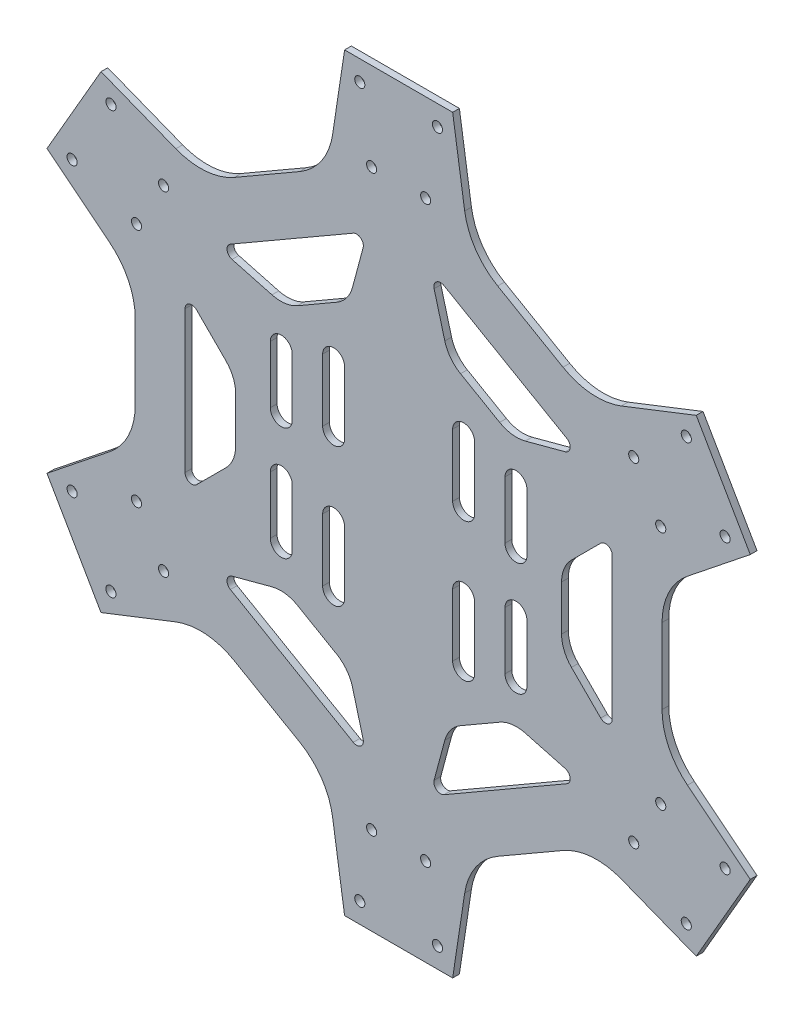
from build123d import *

# Parameters (mm, degrees)
BOSS_EXTRUDE1_DEPTH = 2
CUT_EXTRUDE1_REACH  = 306.4
CUT_EXTRUDE2_REACH  = 306.4
CUT_EXTRUDE3_REACH  = 306.4
SKETCH4_R           = 1.5


with BuildPart() as part:
    # Sketch1 → Boss-Extrude1 (new body)
    with BuildSketch(Plane.XY):
        with BuildLine():
            Line((88.12881982, 222), (84.568261253, 198.459214885))
            ThreePointArc((84.568261253, 198.459214885), (81.315061134, 190.17956792), (74.793177049, 184.129700743))
            Line((74.793177049, 184.129700743), (55.464462591, 172.970262248))
            ThreePointArc((55.464462591, 172.970262248), (46.964181884, 170.347078538), (38.167197219, 171.669548074))
            Line((38.167197219, 171.669548074), (16, 180.356406461))
            Line((16, 180.356406461), (0, 152.643593539))
            Line((0, 152.643593539), (18.606638651, 137.789666811))
            ThreePointArc((18.606638651, 137.789666811), (24.150423198, 130.832489382), (26.12881982, 122.159438495))
            Line((26.12881982, 122.159438495), (26.12881982, 99.840561505))
            ThreePointArc((26.12881982, 99.840561505), (24.150423198, 91.167510618), (18.606638651, 84.210333189))
            Line((18.606638651, 84.210333189), (0, 69.356406461))
            Line((0, 69.356406461), (16, 41.643593539))
            Line((16, 41.643593539), (38.167197219, 50.330451926))
            ThreePointArc((38.167197219, 50.330451926), (46.964181884, 51.652921462), (55.464462591, 49.029737752))
            Line((55.464462591, 49.029737752), (74.793177049, 37.870299257))
            ThreePointArc((74.793177049, 37.870299257), (81.315061134, 31.82043208), (84.568261253, 23.540785115))
            Line((84.568261253, 23.540785115), (88.12881982, 0))
            Line((88.12881982, 0), (120.12881982, 0))
            Line((120.12881982, 0), (123.689378387, 23.540785115))
            ThreePointArc((123.689378387, 23.540785115), (126.942578506, 31.82043208), (133.464462591, 37.870299257))
            Line((133.464462591, 37.870299257), (152.793177049, 49.029737752))
            ThreePointArc((152.793177049, 49.029737752), (161.293457756, 51.652921462), (170.090442422, 50.330451926))
            Line((170.090442422, 50.330451926), (192.25763964, 41.643593539))
            Line((192.25763964, 41.643593539), (208.25763964, 69.356406461))
            Line((208.25763964, 69.356406461), (189.651000989, 84.210333189))
            ThreePointArc((189.651000989, 84.210333189), (184.107216442, 91.167510618), (182.12881982, 99.840561505))
            Line((182.12881982, 99.840561505), (182.12881982, 122.159438495))
            ThreePointArc((182.12881982, 122.159438495), (184.107216442, 130.832489382), (189.651000989, 137.789666811))
            Line((189.651000989, 137.789666811), (208.25763964, 152.643593539))
            Line((208.25763964, 152.643593539), (192.25763964, 180.356406461))
            Line((192.25763964, 180.356406461), (170.090442422, 171.669548074))
            ThreePointArc((170.090442422, 171.669548074), (161.293457756, 170.347078538), (152.793177049, 172.970262248))
            Line((152.793177049, 172.970262248), (133.464462591, 184.129700743))
            ThreePointArc((133.464462591, 184.129700743), (126.942578506, 190.17956792), (123.689378387, 198.459214885))
            Line((123.689378387, 198.459214885), (120.12881982, 222))
            Line((120.12881982, 222), (88.12881982, 222))
        make_face()
    extrude(amount=BOSS_EXTRUDE1_DEPTH)

    # Sketch2 → Cut-Extrude1 (cut, up to next)
    with BuildSketch(Plane.XY.offset(2), mode=Mode.PRIVATE) as cut_extrude1_sk1:
        with BuildLine():
            Line((153.9403533, 155.276106789), (117.567286341, 176.276106789))
            ThreePointArc((117.567286341, 176.276106789), (115.349763483, 176.130762662), (114.635434688, 174.026417892))
            Line((114.635434688, 174.026417892), (117.80406326, 162.20093507))
            ThreePointArc((117.80406326, 162.20093507), (119.52978812, 158.701511231), (122.463321523, 156.128871483))
            Line((122.463321523, 156.128871483), (134.044318117, 149.442579982))
            ThreePointArc((134.044318117, 149.442579982), (137.739056195, 148.188385406), (141.632508568, 148.443575757))
            Line((141.632508568, 148.443575757), (153.45799139, 151.612204329))
            ThreePointArc((153.45799139, 151.612204329), (154.923243022, 153.283003597), (153.9403533, 155.276106789))
        make_face()
    cut_extrude1_tool1 = extrude(cut_extrude1_sk1.sketch, amount=-CUT_EXTRUDE1_REACH, mode=Mode.PRIVATE) & part.part
    # Sketch2 → Cut-Extrude1 (cut, up to next)
    with BuildSketch(Plane.XY.offset(2), mode=Mode.PRIVATE) as cut_extrude1_sk2:
        with BuildLine():
            Line((152.37881982, 104.313708499), (152.37881982, 117.686291501))
            ThreePointArc((152.37881982, 117.686291501), (153.140024495, 121.513125825), (155.307752008, 124.757359313))
            Line((155.307752008, 124.757359313), (163.964606258, 133.414213562))
            ThreePointArc((163.964606258, 133.414213562), (166.144186685, 133.847759065), (167.37881982, 132))
            Line((167.37881982, 132), (167.37881982, 90))
            ThreePointArc((167.37881982, 90), (166.144186685, 88.152240935), (163.964606258, 88.585786438))
            Line((163.964606258, 88.585786438), (155.307752008, 97.242640687))
            ThreePointArc((155.307752008, 97.242640687), (153.140024495, 100.486874175), (152.37881982, 104.313708499))
        make_face()
    cut_extrude1_tool2 = extrude(cut_extrude1_sk2.sketch, amount=-CUT_EXTRUDE1_REACH, mode=Mode.PRIVATE) & part.part
    # Sketch2 → Cut-Extrude1 (cut, up to next)
    with BuildSketch(Plane.XY.offset(2), mode=Mode.PRIVATE) as cut_extrude1_sk3:
        with BuildLine():
            Line((122.463321523, 65.871128517), (134.044318117, 72.557420018))
            ThreePointArc((134.044318117, 72.557420018), (137.739056195, 73.811614594), (141.632508568, 73.556424243))
            Line((141.632508568, 73.556424243), (153.45799139, 70.387795671))
            ThreePointArc((153.45799139, 70.387795671), (154.923243022, 68.716996403), (153.9403533, 66.723893211))
            Line((153.9403533, 66.723893211), (117.567286341, 45.723893211))
            ThreePointArc((117.567286341, 45.723893211), (115.349763483, 45.869237338), (114.635434688, 47.973582108))
            Line((114.635434688, 47.973582108), (117.80406326, 59.79906493))
            ThreePointArc((117.80406326, 59.79906493), (119.52978812, 63.298488769), (122.463321523, 65.871128517))
        make_face()
    cut_extrude1_tool3 = extrude(cut_extrude1_sk3.sketch, amount=-CUT_EXTRUDE1_REACH, mode=Mode.PRIVATE) & part.part
    # Sketch2 → Cut-Extrude1 (cut, up to next)
    with BuildSketch(Plane.XY.offset(2), mode=Mode.PRIVATE) as cut_extrude1_sk4:
        with BuildLine():
            Line((74.213321523, 72.557420018), (85.794318117, 65.871128517))
            ThreePointArc((85.794318117, 65.871128517), (88.72785152, 63.298488769), (90.45357638, 59.79906493))
            Line((90.45357638, 59.79906493), (93.622204952, 47.973582108))
            ThreePointArc((93.622204952, 47.973582108), (92.907876158, 45.869237338), (90.6903533, 45.723893211))
            Line((90.6903533, 45.723893211), (54.317286341, 66.723893211))
            ThreePointArc((54.317286341, 66.723893211), (53.334396618, 68.716996403), (54.79964825, 70.387795671))
            Line((54.79964825, 70.387795671), (66.625131072, 73.556424243))
            ThreePointArc((66.625131072, 73.556424243), (70.518583445, 73.811614594), (74.213321523, 72.557420018))
        make_face()
    cut_extrude1_tool4 = extrude(cut_extrude1_sk4.sketch, amount=-CUT_EXTRUDE1_REACH, mode=Mode.PRIVATE) & part.part
    # Sketch2 → Cut-Extrude1 (cut, up to next)
    with BuildSketch(Plane.XY.offset(2), mode=Mode.PRIVATE) as cut_extrude1_sk5:
        with BuildLine():
            Line((55.87881982, 117.686291501), (55.87881982, 104.313708499))
            ThreePointArc((55.87881982, 104.313708499), (55.117615145, 100.486874175), (52.949887632, 97.242640687))
            Line((52.949887632, 97.242640687), (44.293033382, 88.585786438))
            ThreePointArc((44.293033382, 88.585786438), (42.113452955, 88.152240935), (40.87881982, 90))
            Line((40.87881982, 90), (40.87881982, 132))
            ThreePointArc((40.87881982, 132), (42.113452955, 133.847759065), (44.293033382, 133.414213562))
            Line((44.293033382, 133.414213562), (52.949887632, 124.757359313))
            ThreePointArc((52.949887632, 124.757359313), (55.117615145, 121.513125825), (55.87881982, 117.686291501))
        make_face()
    cut_extrude1_tool5 = extrude(cut_extrude1_sk5.sketch, amount=-CUT_EXTRUDE1_REACH, mode=Mode.PRIVATE) & part.part
    # Sketch2 → Cut-Extrude1 (cut, up to next)
    with BuildSketch(Plane.XY.offset(2), mode=Mode.PRIVATE) as cut_extrude1_sk6:
        with BuildLine():
            Line((85.794318117, 156.128871483), (74.213321523, 149.442579982))
            ThreePointArc((74.213321523, 149.442579982), (70.518583445, 148.188385406), (66.625131072, 148.443575757))
            Line((66.625131072, 148.443575757), (54.79964825, 151.612204329))
            ThreePointArc((54.79964825, 151.612204329), (53.334396618, 153.283003597), (54.317286341, 155.276106789))
            Line((54.317286341, 155.276106789), (90.6903533, 176.276106789))
            ThreePointArc((90.6903533, 176.276106789), (92.907876158, 176.130762662), (93.622204952, 174.026417892))
            Line((93.622204952, 174.026417892), (90.45357638, 162.20093507))
            ThreePointArc((90.45357638, 162.20093507), (88.72785152, 158.701511231), (85.794318117, 156.128871483))
        make_face()
    cut_extrude1_tool6 = extrude(cut_extrude1_sk6.sketch, amount=-CUT_EXTRUDE1_REACH, mode=Mode.PRIVATE) & part.part
    add(cut_extrude1_tool1.solids().sort_by_distance((132.495552, 160.132622, 2))[0], mode=Mode.SUBTRACT)
    add(cut_extrude1_tool2.solids().sort_by_distance((160.862284, 111, 2))[0], mode=Mode.SUBTRACT)
    add(cut_extrude1_tool3.solids().sort_by_distance((132.495552, 61.867378, 2))[0], mode=Mode.SUBTRACT)
    add(cut_extrude1_tool4.solids().sort_by_distance((75.762088, 61.867378, 2))[0], mode=Mode.SUBTRACT)
    add(cut_extrude1_tool5.solids().sort_by_distance((47.395355, 111, 2))[0], mode=Mode.SUBTRACT)
    add(cut_extrude1_tool6.solids().sort_by_distance((75.762088, 160.132622, 2))[0], mode=Mode.SUBTRACT)

    # Sketch3 → Cut-Extrude2 (cut, up to next)
    with BuildSketch(Plane.XY.offset(2), mode=Mode.PRIVATE) as cut_extrude2_sk1:
        with BuildLine():
            Line((72.62881982, 136.25), (72.62881982, 119.25))
            ThreePointArc((72.62881982, 119.25), (69.37881982, 116), (66.12881982, 119.25))
            Line((66.12881982, 119.25), (66.12881982, 136.25))
            ThreePointArc((66.12881982, 136.25), (69.37881982, 139.5), (72.62881982, 136.25))
        make_face()
    cut_extrude2_tool1 = extrude(cut_extrude2_sk1.sketch, amount=-CUT_EXTRUDE2_REACH, mode=Mode.PRIVATE) & part.part
    # Sketch3 → Cut-Extrude2 (cut, up to next)
    with BuildSketch(Plane.XY.offset(2), mode=Mode.PRIVATE) as cut_extrude2_sk2:
        with BuildLine():
            Line((88.12881982, 140.75), (88.12881982, 122.25))
            ThreePointArc((88.12881982, 122.25), (84.87881982, 119), (81.62881982, 122.25))
            Line((81.62881982, 122.25), (81.62881982, 140.75))
            ThreePointArc((81.62881982, 140.75), (84.87881982, 144), (88.12881982, 140.75))
        make_face()
    cut_extrude2_tool2 = extrude(cut_extrude2_sk2.sketch, amount=-CUT_EXTRUDE2_REACH, mode=Mode.PRIVATE) & part.part
    # Sketch3 → Cut-Extrude2 (cut, up to next)
    with BuildSketch(Plane.XY.offset(2), mode=Mode.PRIVATE) as cut_extrude2_sk3:
        with BuildLine():
            Line((72.62881982, 102.75), (72.62881982, 85.75))
            ThreePointArc((72.62881982, 85.75), (69.37881982, 82.5), (66.12881982, 85.75))
            Line((66.12881982, 85.75), (66.12881982, 102.75))
            ThreePointArc((66.12881982, 102.75), (69.37881982, 106), (72.62881982, 102.75))
        make_face()
    cut_extrude2_tool3 = extrude(cut_extrude2_sk3.sketch, amount=-CUT_EXTRUDE2_REACH, mode=Mode.PRIVATE) & part.part
    # Sketch3 → Cut-Extrude2 (cut, up to next)
    with BuildSketch(Plane.XY.offset(2), mode=Mode.PRIVATE) as cut_extrude2_sk4:
        with BuildLine():
            Line((88.12881982, 99.75), (88.12881982, 81.25))
            ThreePointArc((88.12881982, 81.25), (84.87881982, 78), (81.62881982, 81.25))
            Line((81.62881982, 81.25), (81.62881982, 99.75))
            ThreePointArc((81.62881982, 99.75), (84.87881982, 103), (88.12881982, 99.75))
        make_face()
    cut_extrude2_tool4 = extrude(cut_extrude2_sk4.sketch, amount=-CUT_EXTRUDE2_REACH, mode=Mode.PRIVATE) & part.part
    # Sketch3 → Cut-Extrude2 (cut, up to next)
    with BuildSketch(Plane.XY.offset(2), mode=Mode.PRIVATE) as cut_extrude2_sk5:
        with BuildLine():
            Line((120.12881982, 99.75), (120.12881982, 81.25))
            ThreePointArc((120.12881982, 81.25), (123.37881982, 78), (126.62881982, 81.25))
            Line((126.62881982, 81.25), (126.62881982, 99.75))
            ThreePointArc((126.62881982, 99.75), (123.37881982, 103), (120.12881982, 99.75))
        make_face()
    cut_extrude2_tool5 = extrude(cut_extrude2_sk5.sketch, amount=-CUT_EXTRUDE2_REACH, mode=Mode.PRIVATE) & part.part
    # Sketch3 → Cut-Extrude2 (cut, up to next)
    with BuildSketch(Plane.XY.offset(2), mode=Mode.PRIVATE) as cut_extrude2_sk6:
        with BuildLine():
            Line((135.62881982, 102.75), (135.62881982, 85.75))
            ThreePointArc((135.62881982, 85.75), (138.87881982, 82.5), (142.12881982, 85.75))
            Line((142.12881982, 85.75), (142.12881982, 102.75))
            ThreePointArc((142.12881982, 102.75), (138.87881982, 106), (135.62881982, 102.75))
        make_face()
    cut_extrude2_tool6 = extrude(cut_extrude2_sk6.sketch, amount=-CUT_EXTRUDE2_REACH, mode=Mode.PRIVATE) & part.part
    # Sketch3 → Cut-Extrude2 (cut, up to next)
    with BuildSketch(Plane.XY.offset(2), mode=Mode.PRIVATE) as cut_extrude2_sk7:
        with BuildLine():
            Line((120.12881982, 140.75), (120.12881982, 122.25))
            ThreePointArc((120.12881982, 122.25), (123.37881982, 119), (126.62881982, 122.25))
            Line((126.62881982, 122.25), (126.62881982, 140.75))
            ThreePointArc((126.62881982, 140.75), (123.37881982, 144), (120.12881982, 140.75))
        make_face()
    cut_extrude2_tool7 = extrude(cut_extrude2_sk7.sketch, amount=-CUT_EXTRUDE2_REACH, mode=Mode.PRIVATE) & part.part
    # Sketch3 → Cut-Extrude2 (cut, up to next)
    with BuildSketch(Plane.XY.offset(2), mode=Mode.PRIVATE) as cut_extrude2_sk8:
        with BuildLine():
            Line((135.62881982, 136.25), (135.62881982, 119.25))
            ThreePointArc((135.62881982, 119.25), (138.87881982, 116), (142.12881982, 119.25))
            Line((142.12881982, 119.25), (142.12881982, 136.25))
            ThreePointArc((142.12881982, 136.25), (138.87881982, 139.5), (135.62881982, 136.25))
        make_face()
    cut_extrude2_tool8 = extrude(cut_extrude2_sk8.sketch, amount=-CUT_EXTRUDE2_REACH, mode=Mode.PRIVATE) & part.part
    add(cut_extrude2_tool1.solids().sort_by_distance((69.37882, 127.75, 2))[0], mode=Mode.SUBTRACT)
    add(cut_extrude2_tool2.solids().sort_by_distance((84.87882, 131.5, 2))[0], mode=Mode.SUBTRACT)
    add(cut_extrude2_tool3.solids().sort_by_distance((69.37882, 94.25, 2))[0], mode=Mode.SUBTRACT)
    add(cut_extrude2_tool4.solids().sort_by_distance((84.87882, 90.5, 2))[0], mode=Mode.SUBTRACT)
    add(cut_extrude2_tool5.solids().sort_by_distance((123.37882, 90.5, 2))[0], mode=Mode.SUBTRACT)
    add(cut_extrude2_tool6.solids().sort_by_distance((138.87882, 94.25, 2))[0], mode=Mode.SUBTRACT)
    add(cut_extrude2_tool7.solids().sort_by_distance((123.37882, 131.5, 2))[0], mode=Mode.SUBTRACT)
    add(cut_extrude2_tool8.solids().sort_by_distance((138.87882, 127.75, 2))[0], mode=Mode.SUBTRACT)

    # Sketch4 → Cut-Extrude3 (cut, up to next)
    with BuildSketch(Plane.XY.offset(2), mode=Mode.PRIVATE) as cut_extrude3_sk1:
        with Locations((92.62881982, 216)):
            Circle(SKETCH4_R)
    cut_extrude3_tool1 = extrude(cut_extrude3_sk1.sketch, amount=-CUT_EXTRUDE3_REACH, mode=Mode.PRIVATE) & part.part
    # Sketch4 → Cut-Extrude3 (cut, up to next)
    with BuildSketch(Plane.XY.offset(2), mode=Mode.PRIVATE) as cut_extrude3_sk2:
        with Locations((115.62881982, 216)):
            Circle(SKETCH4_R)
    cut_extrude3_tool2 = extrude(cut_extrude3_sk2.sketch, amount=-CUT_EXTRUDE3_REACH, mode=Mode.PRIVATE) & part.part
    # Sketch4 → Cut-Extrude3 (cut, up to next)
    with BuildSketch(Plane.XY.offset(2), mode=Mode.PRIVATE) as cut_extrude3_sk3:
        with Locations((96.12881982, 196)):
            Circle(SKETCH4_R)
    cut_extrude3_tool3 = extrude(cut_extrude3_sk3.sketch, amount=-CUT_EXTRUDE3_REACH, mode=Mode.PRIVATE) & part.part
    # Sketch4 → Cut-Extrude3 (cut, up to next)
    with BuildSketch(Plane.XY.offset(2), mode=Mode.PRIVATE) as cut_extrude3_sk4:
        with Locations((112.12881982, 196)):
            Circle(SKETCH4_R)
    cut_extrude3_tool4 = extrude(cut_extrude3_sk4.sketch, amount=-CUT_EXTRUDE3_REACH, mode=Mode.PRIVATE) & part.part
    # Sketch4 → Cut-Extrude3 (cut, up to next)
    with BuildSketch(Plane.XY.offset(2), mode=Mode.PRIVATE) as cut_extrude3_sk5:
        with Locations((173.740979142, 160.42820323)):
            Circle(SKETCH4_R)
    cut_extrude3_tool5 = extrude(cut_extrude3_sk5.sketch, amount=-CUT_EXTRUDE3_REACH, mode=Mode.PRIVATE) & part.part
    # Sketch4 → Cut-Extrude3 (cut, up to next)
    with BuildSketch(Plane.XY.offset(2), mode=Mode.PRIVATE) as cut_extrude3_sk6:
        with Locations((181.740979142, 146.57179677)):
            Circle(SKETCH4_R)
    cut_extrude3_tool6 = extrude(cut_extrude3_sk6.sketch, amount=-CUT_EXTRUDE3_REACH, mode=Mode.PRIVATE) & part.part
    # Sketch4 → Cut-Extrude3 (cut, up to next)
    with BuildSketch(Plane.XY.offset(2), mode=Mode.PRIVATE) as cut_extrude3_sk7:
        with Locations((200.811487217, 153.540707856)):
            Circle(SKETCH4_R)
    cut_extrude3_tool7 = extrude(cut_extrude3_sk7.sketch, amount=-CUT_EXTRUDE3_REACH, mode=Mode.PRIVATE) & part.part
    # Sketch4 → Cut-Extrude3 (cut, up to next)
    with BuildSketch(Plane.XY.offset(2), mode=Mode.PRIVATE) as cut_extrude3_sk8:
        with Locations((189.311487217, 173.459292144)):
            Circle(SKETCH4_R)
    cut_extrude3_tool8 = extrude(cut_extrude3_sk8.sketch, amount=-CUT_EXTRUDE3_REACH, mode=Mode.PRIVATE) & part.part
    # Sketch4 → Cut-Extrude3 (cut, up to next)
    with BuildSketch(Plane.XY.offset(2), mode=Mode.PRIVATE) as cut_extrude3_sk9:
        with Locations((181.740979142, 75.42820323)):
            Circle(SKETCH4_R)
    cut_extrude3_tool9 = extrude(cut_extrude3_sk9.sketch, amount=-CUT_EXTRUDE3_REACH, mode=Mode.PRIVATE) & part.part
    # Sketch4 → Cut-Extrude3 (cut, up to next)
    with BuildSketch(Plane.XY.offset(2), mode=Mode.PRIVATE) as cut_extrude3_sk10:
        with Locations((173.740979142, 61.57179677)):
            Circle(SKETCH4_R)
    cut_extrude3_tool10 = extrude(cut_extrude3_sk10.sketch, amount=-CUT_EXTRUDE3_REACH, mode=Mode.PRIVATE) & part.part
    # Sketch4 → Cut-Extrude3 (cut, up to next)
    with BuildSketch(Plane.XY.offset(2), mode=Mode.PRIVATE) as cut_extrude3_sk11:
        with Locations((189.311487217, 48.540707856)):
            Circle(SKETCH4_R)
    cut_extrude3_tool11 = extrude(cut_extrude3_sk11.sketch, amount=-CUT_EXTRUDE3_REACH, mode=Mode.PRIVATE) & part.part
    # Sketch4 → Cut-Extrude3 (cut, up to next)
    with BuildSketch(Plane.XY.offset(2), mode=Mode.PRIVATE) as cut_extrude3_sk12:
        with Locations((200.811487217, 68.459292144)):
            Circle(SKETCH4_R)
    cut_extrude3_tool12 = extrude(cut_extrude3_sk12.sketch, amount=-CUT_EXTRUDE3_REACH, mode=Mode.PRIVATE) & part.part
    # Sketch4 → Cut-Extrude3 (cut, up to next)
    with BuildSketch(Plane.XY.offset(2), mode=Mode.PRIVATE) as cut_extrude3_sk13:
        with Locations((112.12881982, 26)):
            Circle(SKETCH4_R)
    cut_extrude3_tool13 = extrude(cut_extrude3_sk13.sketch, amount=-CUT_EXTRUDE3_REACH, mode=Mode.PRIVATE) & part.part
    # Sketch4 → Cut-Extrude3 (cut, up to next)
    with BuildSketch(Plane.XY.offset(2), mode=Mode.PRIVATE) as cut_extrude3_sk14:
        with Locations((96.12881982, 26)):
            Circle(SKETCH4_R)
    cut_extrude3_tool14 = extrude(cut_extrude3_sk14.sketch, amount=-CUT_EXTRUDE3_REACH, mode=Mode.PRIVATE) & part.part
    # Sketch4 → Cut-Extrude3 (cut, up to next)
    with BuildSketch(Plane.XY.offset(2), mode=Mode.PRIVATE) as cut_extrude3_sk15:
        with Locations((92.62881982, 6)):
            Circle(SKETCH4_R)
    cut_extrude3_tool15 = extrude(cut_extrude3_sk15.sketch, amount=-CUT_EXTRUDE3_REACH, mode=Mode.PRIVATE) & part.part
    # Sketch4 → Cut-Extrude3 (cut, up to next)
    with BuildSketch(Plane.XY.offset(2), mode=Mode.PRIVATE) as cut_extrude3_sk16:
        with Locations((115.62881982, 6)):
            Circle(SKETCH4_R)
    cut_extrude3_tool16 = extrude(cut_extrude3_sk16.sketch, amount=-CUT_EXTRUDE3_REACH, mode=Mode.PRIVATE) & part.part
    # Sketch4 → Cut-Extrude3 (cut, up to next)
    with BuildSketch(Plane.XY.offset(2), mode=Mode.PRIVATE) as cut_extrude3_sk17:
        with Locations((34.516660498, 61.57179677)):
            Circle(SKETCH4_R)
    cut_extrude3_tool17 = extrude(cut_extrude3_sk17.sketch, amount=-CUT_EXTRUDE3_REACH, mode=Mode.PRIVATE) & part.part
    # Sketch4 → Cut-Extrude3 (cut, up to next)
    with BuildSketch(Plane.XY.offset(2), mode=Mode.PRIVATE) as cut_extrude3_sk18:
        with Locations((26.516660498, 75.42820323)):
            Circle(SKETCH4_R)
    cut_extrude3_tool18 = extrude(cut_extrude3_sk18.sketch, amount=-CUT_EXTRUDE3_REACH, mode=Mode.PRIVATE) & part.part
    # Sketch4 → Cut-Extrude3 (cut, up to next)
    with BuildSketch(Plane.XY.offset(2), mode=Mode.PRIVATE) as cut_extrude3_sk19:
        with Locations((7.446152423, 68.459292144)):
            Circle(SKETCH4_R)
    cut_extrude3_tool19 = extrude(cut_extrude3_sk19.sketch, amount=-CUT_EXTRUDE3_REACH, mode=Mode.PRIVATE) & part.part
    # Sketch4 → Cut-Extrude3 (cut, up to next)
    with BuildSketch(Plane.XY.offset(2), mode=Mode.PRIVATE) as cut_extrude3_sk20:
        with Locations((18.946152423, 48.540707856)):
            Circle(SKETCH4_R)
    cut_extrude3_tool20 = extrude(cut_extrude3_sk20.sketch, amount=-CUT_EXTRUDE3_REACH, mode=Mode.PRIVATE) & part.part
    # Sketch4 → Cut-Extrude3 (cut, up to next)
    with BuildSketch(Plane.XY.offset(2), mode=Mode.PRIVATE) as cut_extrude3_sk21:
        with Locations((26.516660498, 146.57179677)):
            Circle(SKETCH4_R)
    cut_extrude3_tool21 = extrude(cut_extrude3_sk21.sketch, amount=-CUT_EXTRUDE3_REACH, mode=Mode.PRIVATE) & part.part
    # Sketch4 → Cut-Extrude3 (cut, up to next)
    with BuildSketch(Plane.XY.offset(2), mode=Mode.PRIVATE) as cut_extrude3_sk22:
        with Locations((34.516660498, 160.42820323)):
            Circle(SKETCH4_R)
    cut_extrude3_tool22 = extrude(cut_extrude3_sk22.sketch, amount=-CUT_EXTRUDE3_REACH, mode=Mode.PRIVATE) & part.part
    # Sketch4 → Cut-Extrude3 (cut, up to next)
    with BuildSketch(Plane.XY.offset(2), mode=Mode.PRIVATE) as cut_extrude3_sk23:
        with Locations((18.946152423, 173.459292144)):
            Circle(SKETCH4_R)
    cut_extrude3_tool23 = extrude(cut_extrude3_sk23.sketch, amount=-CUT_EXTRUDE3_REACH, mode=Mode.PRIVATE) & part.part
    # Sketch4 → Cut-Extrude3 (cut, up to next)
    with BuildSketch(Plane.XY.offset(2), mode=Mode.PRIVATE) as cut_extrude3_sk24:
        with Locations((7.446152423, 153.540707856)):
            Circle(SKETCH4_R)
    cut_extrude3_tool24 = extrude(cut_extrude3_sk24.sketch, amount=-CUT_EXTRUDE3_REACH, mode=Mode.PRIVATE) & part.part
    add(cut_extrude3_tool1.solids().sort_by_distance((92.62882, 216, 2))[0], mode=Mode.SUBTRACT)
    add(cut_extrude3_tool2.solids().sort_by_distance((115.62882, 216, 2))[0], mode=Mode.SUBTRACT)
    add(cut_extrude3_tool3.solids().sort_by_distance((96.12882, 196, 2))[0], mode=Mode.SUBTRACT)
    add(cut_extrude3_tool4.solids().sort_by_distance((112.12882, 196, 2))[0], mode=Mode.SUBTRACT)
    add(cut_extrude3_tool5.solids().sort_by_distance((173.740979, 160.428203, 2))[0], mode=Mode.SUBTRACT)
    add(cut_extrude3_tool6.solids().sort_by_distance((181.740979, 146.571797, 2))[0], mode=Mode.SUBTRACT)
    add(cut_extrude3_tool7.solids().sort_by_distance((200.811487, 153.540708, 2))[0], mode=Mode.SUBTRACT)
    add(cut_extrude3_tool8.solids().sort_by_distance((189.311487, 173.459292, 2))[0], mode=Mode.SUBTRACT)
    add(cut_extrude3_tool9.solids().sort_by_distance((181.740979, 75.428203, 2))[0], mode=Mode.SUBTRACT)
    add(cut_extrude3_tool10.solids().sort_by_distance((173.740979, 61.571797, 2))[0], mode=Mode.SUBTRACT)
    add(cut_extrude3_tool11.solids().sort_by_distance((189.311487, 48.540708, 2))[0], mode=Mode.SUBTRACT)
    add(cut_extrude3_tool12.solids().sort_by_distance((200.811487, 68.459292, 2))[0], mode=Mode.SUBTRACT)
    add(cut_extrude3_tool13.solids().sort_by_distance((112.12882, 26, 2))[0], mode=Mode.SUBTRACT)
    add(cut_extrude3_tool14.solids().sort_by_distance((96.12882, 26, 2))[0], mode=Mode.SUBTRACT)
    add(cut_extrude3_tool15.solids().sort_by_distance((92.62882, 6, 2))[0], mode=Mode.SUBTRACT)
    add(cut_extrude3_tool16.solids().sort_by_distance((115.62882, 6, 2))[0], mode=Mode.SUBTRACT)
    add(cut_extrude3_tool17.solids().sort_by_distance((34.51666, 61.571797, 2))[0], mode=Mode.SUBTRACT)
    add(cut_extrude3_tool18.solids().sort_by_distance((26.51666, 75.428203, 2))[0], mode=Mode.SUBTRACT)
    add(cut_extrude3_tool19.solids().sort_by_distance((7.446152, 68.459292, 2))[0], mode=Mode.SUBTRACT)
    add(cut_extrude3_tool20.solids().sort_by_distance((18.946152, 48.540708, 2))[0], mode=Mode.SUBTRACT)
    add(cut_extrude3_tool21.solids().sort_by_distance((26.51666, 146.571797, 2))[0], mode=Mode.SUBTRACT)
    add(cut_extrude3_tool22.solids().sort_by_distance((34.51666, 160.428203, 2))[0], mode=Mode.SUBTRACT)
    add(cut_extrude3_tool23.solids().sort_by_distance((18.946152, 173.459292, 2))[0], mode=Mode.SUBTRACT)
    add(cut_extrude3_tool24.solids().sort_by_distance((7.446152, 153.540708, 2))[0], mode=Mode.SUBTRACT)


solid = part.part
